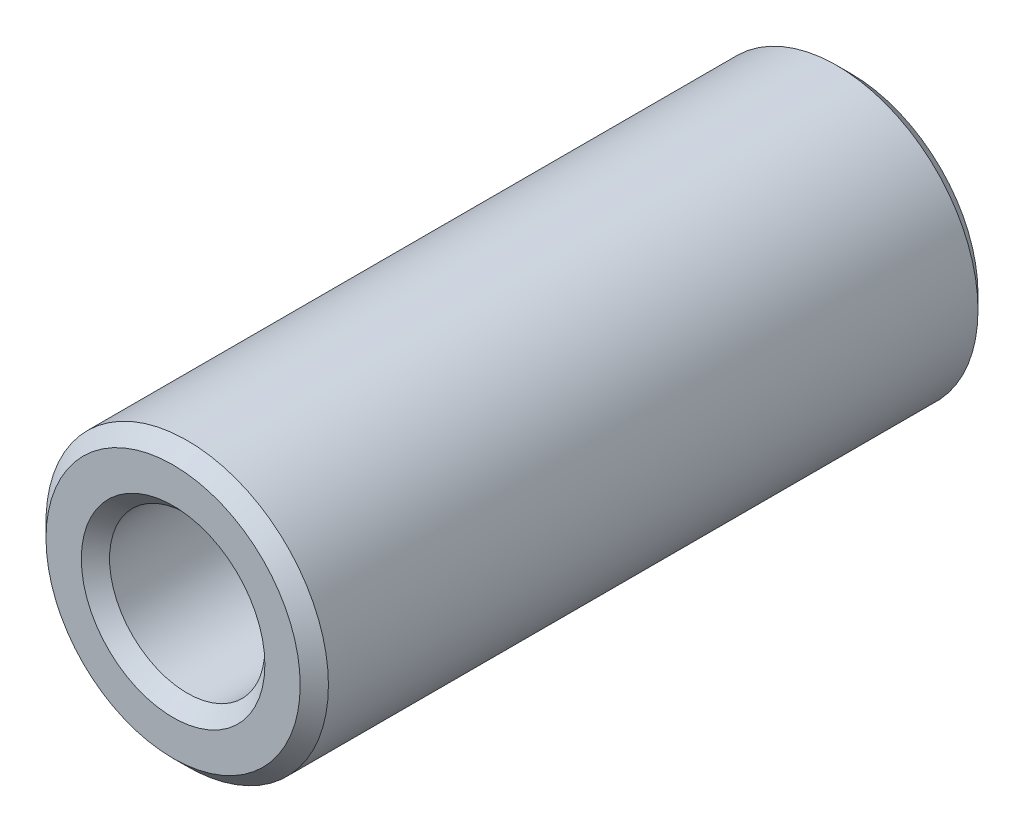
from build123d import *

# Parameters (mm, degrees)
SKETCH1_R           = 5
SKETCH1_R_2         = 2.75
BOSS_EXTRUDE1_DEPTH = 24
CHAMFER1_SIZE       = 0.5


with BuildPart() as part:
    # Sketch1 → Boss-Extrude1 (new body)
    with BuildSketch(Plane.XY):
        Circle(SKETCH1_R)
        Circle(SKETCH1_R_2, mode=Mode.SUBTRACT)
    extrude(amount=BOSS_EXTRUDE1_DEPTH)

    # Chamfer1
    chamfer1_edges = [part.edges().sort_by_distance(p)[0] for p in [
        (-5, 0, 0),
        (-5, 0, 24),
        (-2.75, 0, 0),
        (-2.75, 0, 24),
    ]]
    chamfer(chamfer1_edges, length=CHAMFER1_SIZE)


solid = part.part
